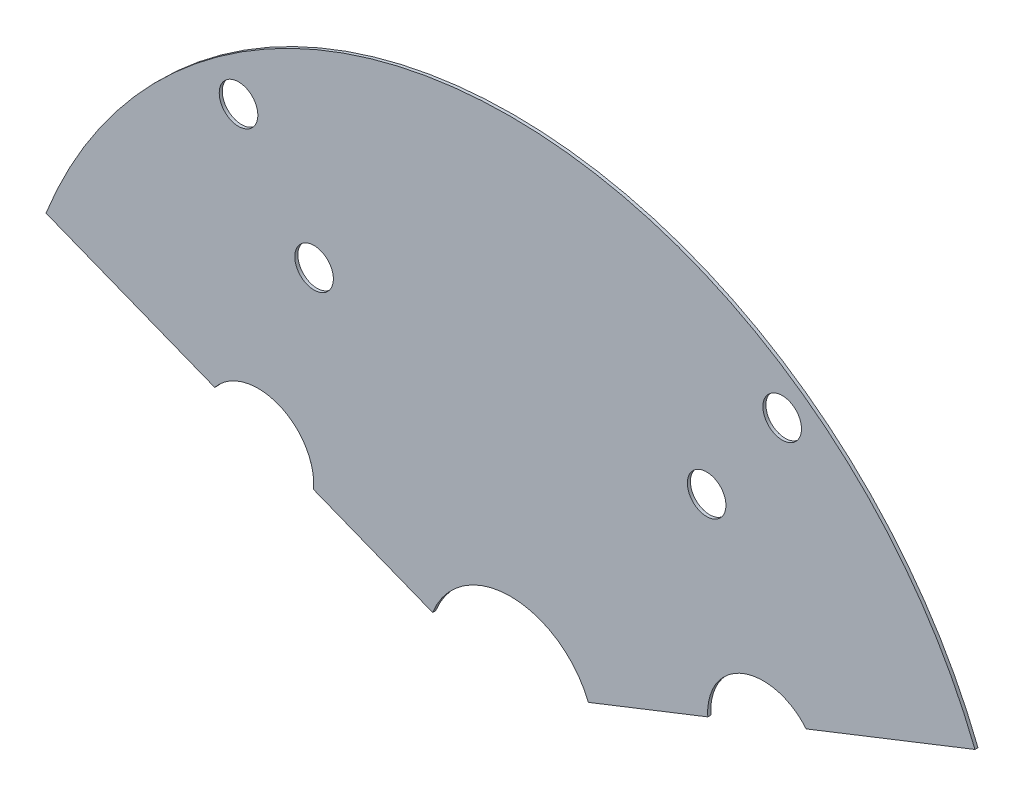
from build123d import *

# Parameters (mm, degrees)
BOSS_EXTRUDE1_DEPTH = 0.3
SKETCH7_R           = 1.905
CUT_EXTRUDE2_DEPTH  = 68.300419328
CUT_EXTRUDE3_DEPTH  = 68.300419328


with BuildPart() as part:
    # Sketch5 → Boss-Extrude1 (new body)
    with BuildSketch(Plane.XY):
        with BuildLine():
            Line((-7.679064705, 3.029354759), (-45.838109317, 18.082917637))
            ThreePointArc((-45.838109317, 18.082917637), (-28.963706092, 39.865121415), (-3.033121883, 49.182561418))
            ThreePointArc((-3.033121883, 49.182561418), (26.454937122, 41.572352326), (45.838109317, 18.082917637))
            Line((45.838109317, 18.082917637), (7.679064705, 3.029354759))
            ThreePointArc((7.679064705, 3.029354759), (4.431883796, 6.964440467), (-0.508126089, 8.239346629))
            ThreePointArc((-0.508126089, 8.239346629), (-4.852167258, 6.678435289), (-7.679064705, 3.029354759))
        make_face()
    extrude(amount=BOSS_EXTRUDE1_DEPTH)

    # Sketch7 → Cut-Extrude2 (cut, through all)
    with BuildSketch(Plane(origin=(0, 0, 0), x_dir=(-1, 0, 0), z_dir=(0, 0, -1))):
        with Locations((-26.813856327, 36.919157691)):
            Circle(SKETCH7_R)
        with Locations((-19.358590444, 26.657864517)):
            Circle(SKETCH7_R)
        with Locations((26.838840816, 36.900999332)):
            Circle(SKETCH7_R)
        with Locations((19.383574933, 26.639706158)):
            Circle(SKETCH7_R)
    extrude(amount=-CUT_EXTRUDE2_DEPTH, mode=Mode.SUBTRACT)

    # Sketch8 → Cut-Extrude3 (cut, through all)
    with BuildSketch(Plane(origin=(0, 0, 0), x_dir=(-1, 0, 0), z_dir=(0, 0, -1))):
        with BuildLine():
            Line((-19.468246955, 7.680131477), (-29.179148849, 11.511036411))
            ThreePointArc((-29.179148849, 11.511036411), (-22.930885785, 13.12620192), (-19.468246955, 7.680131477))
        make_face()
        with BuildLine():
            Line((29.183436436, 11.512727844), (19.425492338, 7.663264983))
            ThreePointArc((19.425492338, 7.663264983), (22.882252084, 13.193140466), (29.183436436, 11.512727844))
        make_face()
    extrude(amount=-CUT_EXTRUDE3_DEPTH, mode=Mode.SUBTRACT)


solid = part.part
